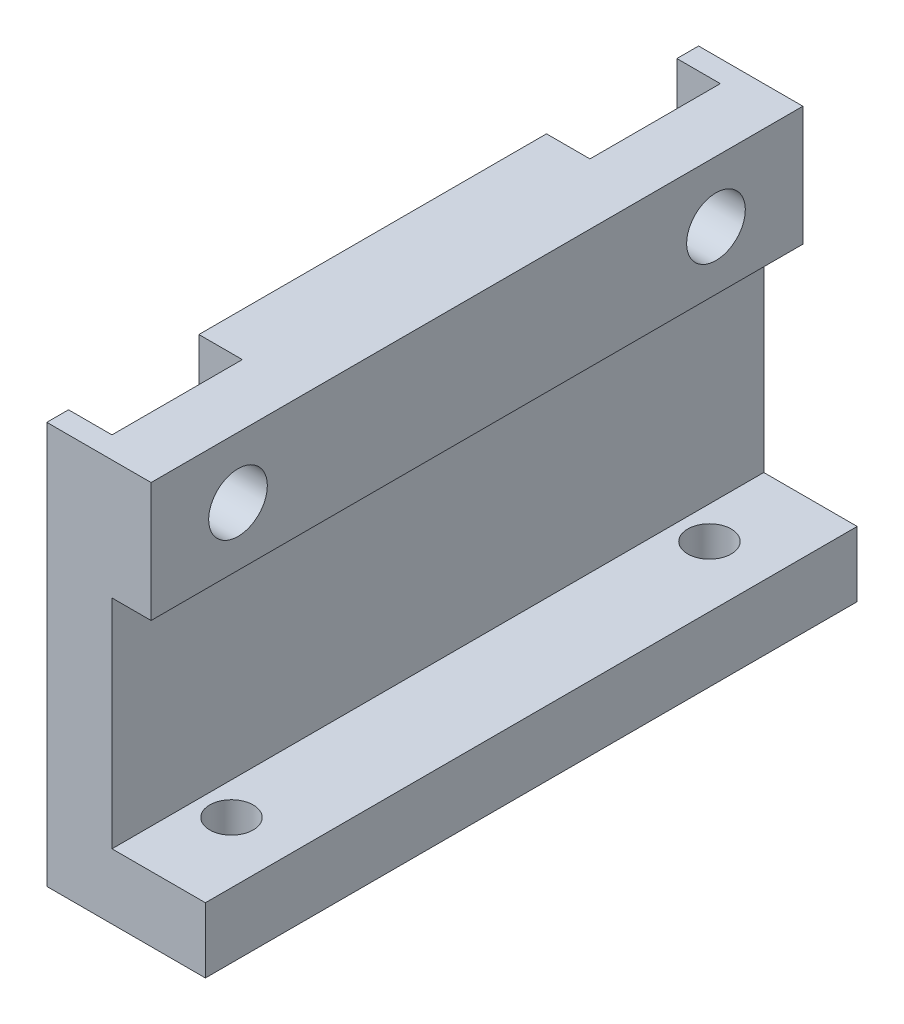
from build123d import *

# Parameters (mm, degrees)
EXTRUDE_1_DEPTH     = 30
CUT_EXTRUDE_1_REACH = 37.994
SKETCH_2_R          = 1
CUT_EXTRUDE_2_REACH = 37.994
SKETCH_3_R          = 1.35
CUT_EXTRUDE_3_DEPTH = 2


with BuildPart() as part:
    # 草图1 → 凸台-拉伸1 (new body)
    with BuildSketch(Plane.XY):
        Polygon((0, 0), (7.3, 0), (7.3, 3), (3, 3), (3, 13), (4.8, 13), (4.8, 18.5), (0, 18.5), align=None)
    extrude(amount=EXTRUDE_1_DEPTH)

    # 草图2 → 切除-拉伸1 (cut, up to next)
    with BuildSketch(Plane.XZ, mode=Mode.PRIVATE) as cut_extrude_1_sk1:
        with Locations((4.5, 26)):
            Circle(SKETCH_2_R)
    cut_extrude_1_tool1 = extrude(cut_extrude_1_sk1.sketch, amount=-CUT_EXTRUDE_1_REACH, mode=Mode.PRIVATE) & part.part
    # 草图2 → 切除-拉伸1 (cut, up to next)
    with BuildSketch(Plane.XZ, mode=Mode.PRIVATE) as cut_extrude_1_sk2:
        with Locations((4.5, 4)):
            Circle(SKETCH_2_R)
    cut_extrude_1_tool2 = extrude(cut_extrude_1_sk2.sketch, amount=-CUT_EXTRUDE_1_REACH, mode=Mode.PRIVATE) & part.part
    add(cut_extrude_1_tool1.solids().sort_by_distance((4.5, 0, 26))[0], mode=Mode.SUBTRACT)
    add(cut_extrude_1_tool2.solids().sort_by_distance((4.5, 0, 4))[0], mode=Mode.SUBTRACT)

    # 草图3 → 切除-拉伸2 (cut, up to next)
    with BuildSketch(Plane.ZY, mode=Mode.PRIVATE) as cut_extrude_2_sk1:
        with Locations(Location((4, 15.7, 0), (0, 0, 270))):
            Circle(SKETCH_3_R)
    cut_extrude_2_tool1 = extrude(cut_extrude_2_sk1.sketch, amount=-CUT_EXTRUDE_2_REACH, mode=Mode.PRIVATE) & part.part
    # 草图3 → 切除-拉伸2 (cut, up to next)
    with BuildSketch(Plane.ZY, mode=Mode.PRIVATE) as cut_extrude_2_sk2:
        with Locations(Location((26, 15.7, 0), (0, 0, 270))):
            Circle(SKETCH_3_R)
    cut_extrude_2_tool2 = extrude(cut_extrude_2_sk2.sketch, amount=-CUT_EXTRUDE_2_REACH, mode=Mode.PRIVATE) & part.part
    add(cut_extrude_2_tool1.solids().sort_by_distance((0, 15.7, 4))[0], mode=Mode.SUBTRACT)
    add(cut_extrude_2_tool2.solids().sort_by_distance((0, 15.7, 26))[0], mode=Mode.SUBTRACT)

    # 草图4 → 切除-拉伸3 (cut)
    with BuildSketch(Plane.ZY):
        with BuildLine():
            Line((1, 15.7), (1, 18.7))
            Line((1, 18.7), (7, 18.7))
            Line((7, 18.7), (7, 15.7))
            ThreePointArc((7, 15.7), (4, 12.7), (1, 15.7))
        make_face()
        with BuildLine():
            Line((23, 15.7), (23, 20.006883846))
            Line((23, 20.006883846), (29, 20.006883846))
            Line((29, 20.006883846), (29, 15.7))
            ThreePointArc((29, 15.7), (26, 12.7), (23, 15.7))
        make_face()
    extrude(amount=-CUT_EXTRUDE_3_DEPTH, mode=Mode.SUBTRACT)


solid = part.part
